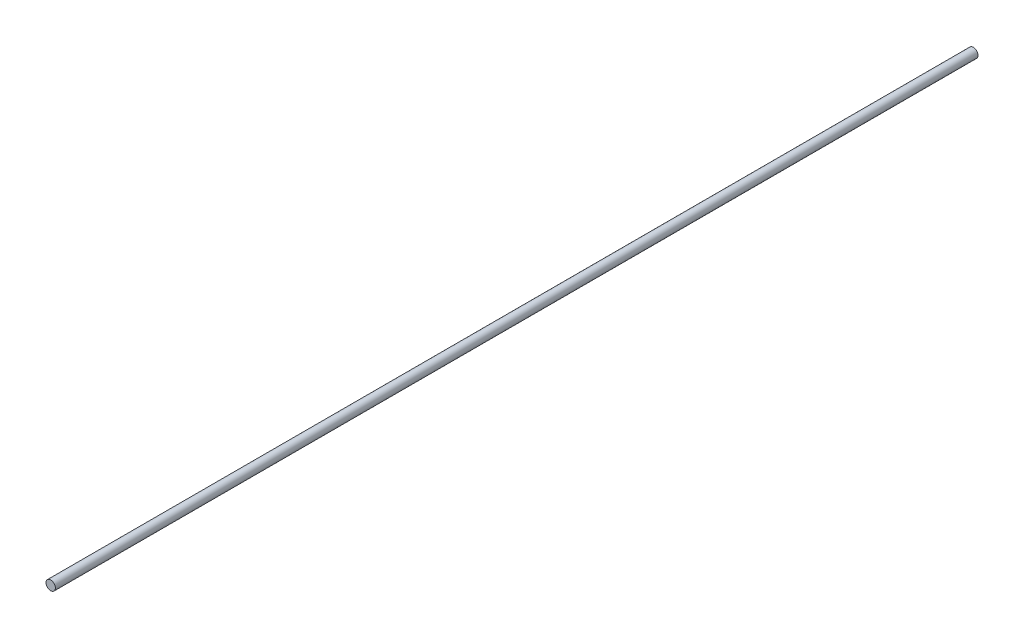
from build123d import *

# Parameters (mm, degrees)
SKETCH1_R           = 7.9375
BOSS_EXTRUDE1_DEPTH = 2254.25
SKETCH2_R           = 7.9375
CUT_EXTRUDE1_DEPTH  = 438.15
CUT_EXTRUDE2_START  = -254
SKETCH3_R           = 7.9375
CUT_EXTRUDE2_DEPTH  = 254


with BuildPart() as part:
    # Sketch1 → Boss-Extrude1 (new body)
    with BuildSketch(Plane.XY):
        Circle(SKETCH1_R)
    extrude(amount=BOSS_EXTRUDE1_DEPTH)

    # Sketch2 → Cut-Extrude1 (cut)
    with BuildSketch(Plane(origin=(0, 0, 0), x_dir=(-1, 0, 0), z_dir=(0, 0, -1))):
        Circle(SKETCH2_R)
    extrude(amount=-CUT_EXTRUDE1_DEPTH, mode=Mode.SUBTRACT)

    # Sketch3 → Cut-Extrude2 (cut)
    with BuildSketch(Plane.XY.offset(2254.25).offset(CUT_EXTRUDE2_START)):
        with Locations(Location((0, 0, 0), (0, 0, 180))):
            Circle(SKETCH3_R)
    extrude(amount=CUT_EXTRUDE2_DEPTH, mode=Mode.SUBTRACT)


solid = part.part
